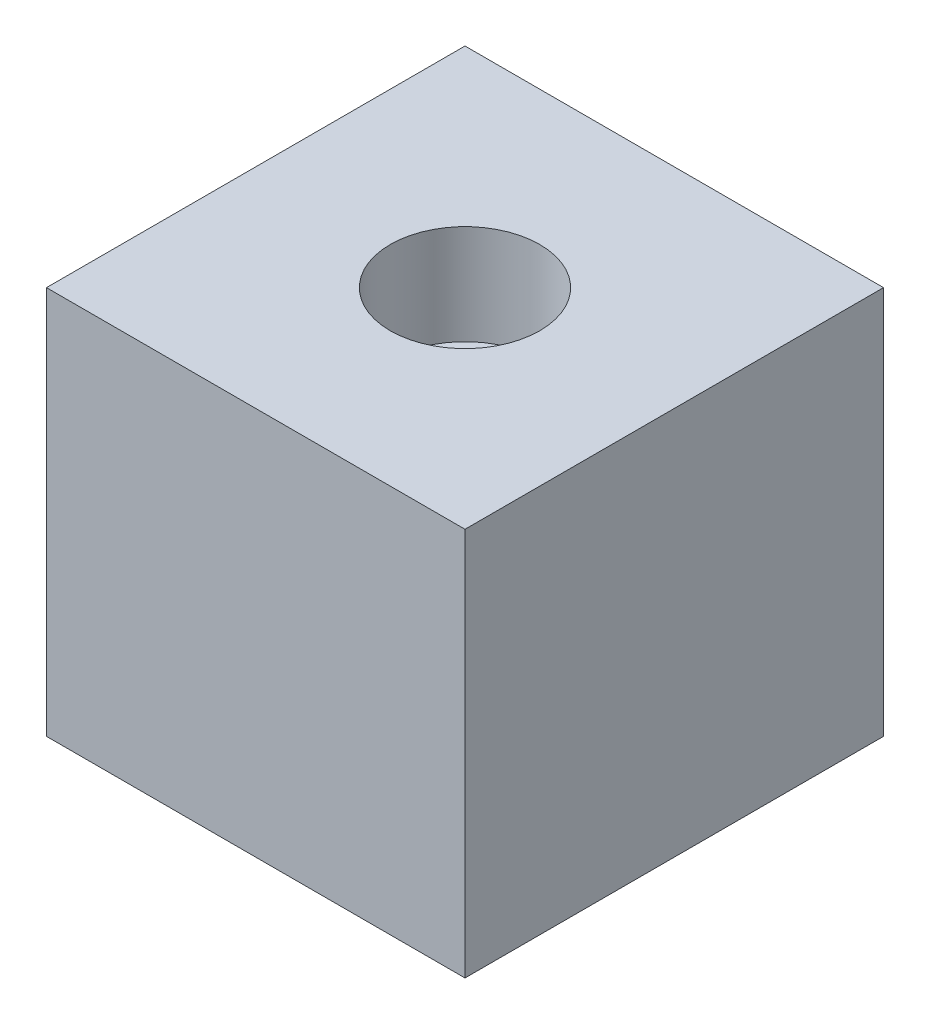
from build123d import *

# Parameters (mm, degrees)
ESQUISSE1_W             = 42
ESQUISSE1_H             = 42
BOSS_EXTRU_1_DEPTH      = 39
ESQUISSE3_R             = 7.5
ENL_V_MAT_EXTRU_2_DEPTH = 10


with BuildPart() as part:
    # Esquisse1 → Boss.-Extru.1 (new body)
    with BuildSketch(Plane(origin=(0, 0, 0), x_dir=(1, 0, 0), z_dir=(0, 1, 0))):
        Rectangle(ESQUISSE1_W, ESQUISSE1_H)
    extrude(amount=BOSS_EXTRU_1_DEPTH)

    # Esquisse3 → Enlèv. mat.-Extru.2 (cut)
    with BuildSketch(Plane(origin=(0, 39, 0), x_dir=(1, 0, 0), z_dir=(0, 1, 0))):
        with Locations(Location((0, 0, 0), (0, 0, 270))):
            Circle(ESQUISSE3_R)
    extrude(amount=-ENL_V_MAT_EXTRU_2_DEPTH, mode=Mode.SUBTRACT)


solid = part.part
